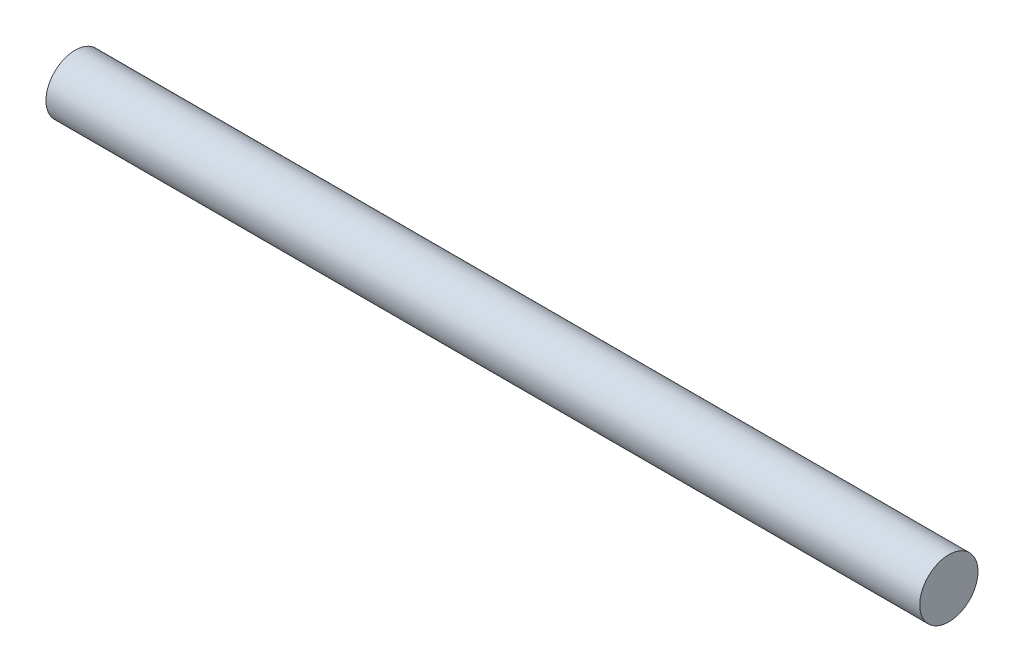
from build123d import *

# Parameters (mm, degrees)
SKETCH1_R           = 5
BOSS_EXTRUDE1_DEPTH = 150


with BuildPart() as part:
    # Sketch1 → Boss-Extrude1 (new body)
    with BuildSketch(Plane(origin=(0, 0, 0), x_dir=(0, 0, -1), z_dir=(1, 0, 0))):
        Circle(SKETCH1_R)
    extrude(amount=BOSS_EXTRUDE1_DEPTH)


solid = part.part
